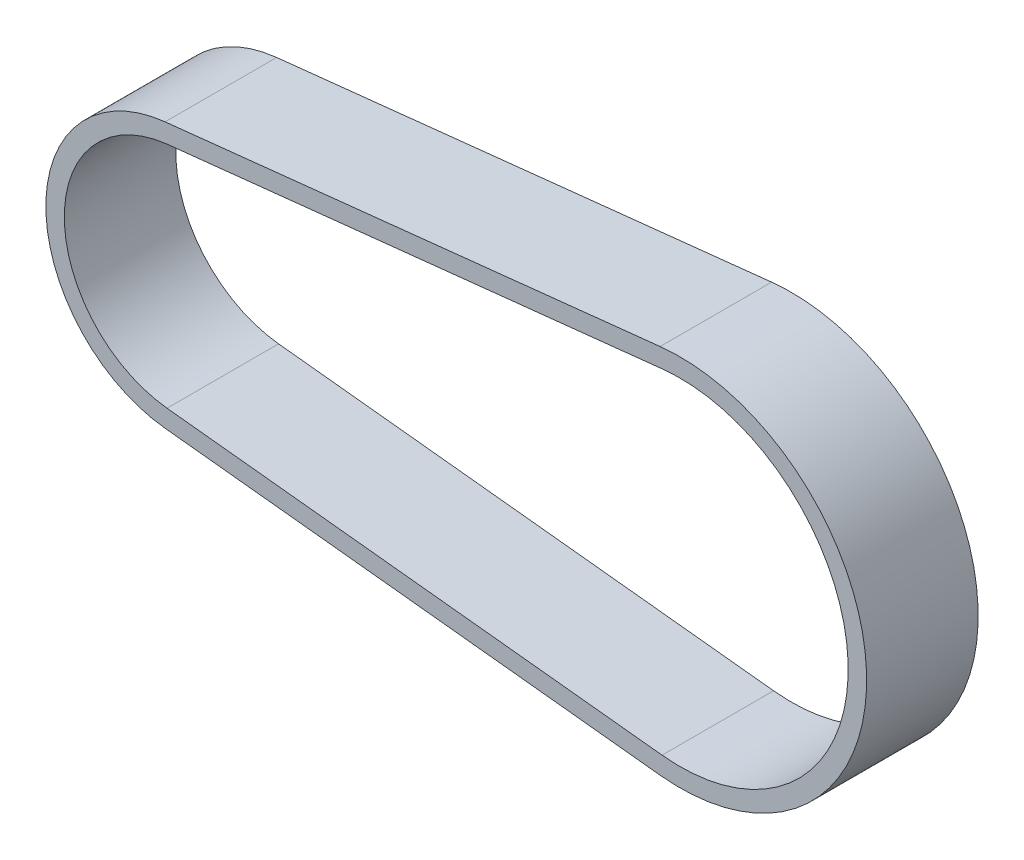
from build123d import *

# Parameters (mm, degrees)
EXTRUDE_1_DEPTH = 20


with BuildPart() as part:
    # ｽｹｯﾁ1 → 押し出し-薄板1 (new body)
    with BuildSketch(Plane.XY):
        with BuildLine():
            Line((-92.345425947, 23.799265362), (-3.561043987, 33.295107609))
            ThreePointArc((-3.561043987, 33.295107609), (33.485, 0), (-3.561043987, -33.295107609))
            Line((-3.561043987, -33.295107609), (-92.345425947, -23.799265362))
            ThreePointArc((-92.345425947, -23.799265362), (-113.735, 0), (-92.345425947, 23.799265362))
        make_face()
        with BuildLine():
            Line((-91.993415924, 20.508036268), (-3.209033964, 30.003878516))
            ThreePointArc((-3.209033964, 30.003878516), (30.175, 0), (-3.209033964, -30.003878516))
            Line((-3.209033964, -30.003878516), (-91.993415924, -20.508036268))
            ThreePointArc((-91.993415924, -20.508036268), (-110.425, 0), (-91.993415924, 20.508036268))
        make_face(mode=Mode.SUBTRACT)
    extrude(amount=EXTRUDE_1_DEPTH)


solid = part.part
